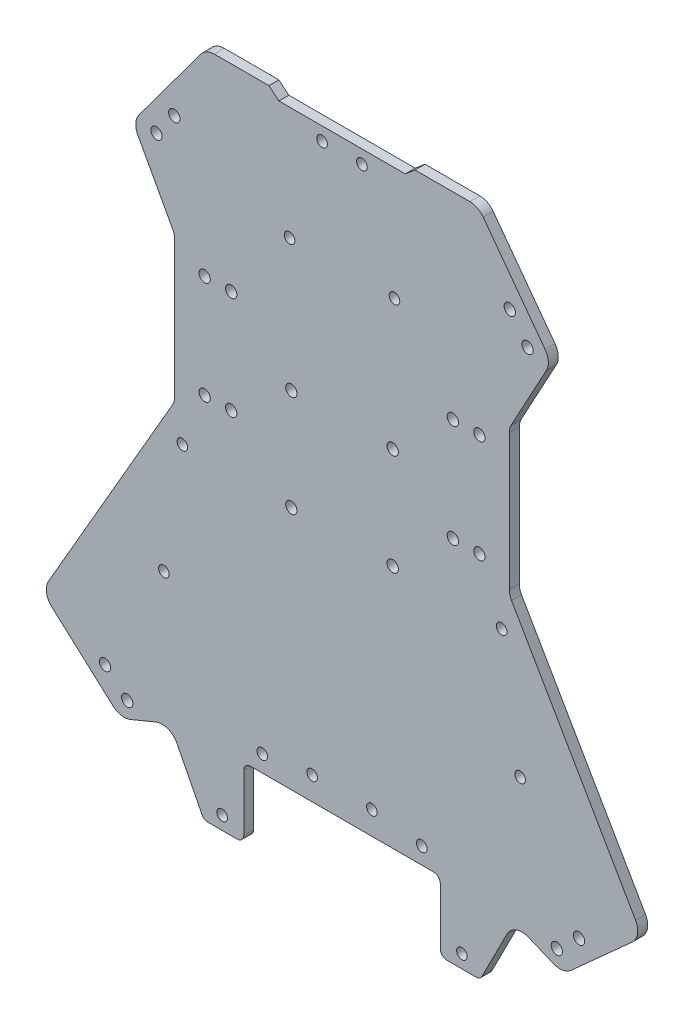
from build123d import *

# Parameters (mm, degrees)
BOSS_EXTRUDE1_DEPTH  = 3
SKETCH1_3_R          = 1.6
CUT_EXTRUDE1_DEPTH   = 219.249429386
MNTPATT_LNDGEAR_D    = 3.4
MNTPATT_REARARM_D    = 3.4
MNTPATT_FOREARM_D    = 3.4
FILLET1_R            = 5
FILLET2_R            = 2
M3_CLEARANCE_HOLE4_D = 3.4


with BuildPart() as part:
    # Sketch1 → Boss-Extrude1 (new body)
    with BuildSketch(Plane.XY):
        Polygon((0, 0), (19, 0), (21.979383981, 2.5), (40.979383981, 2.5), (62.987827091, -27.242703843), (50.343119944, -50.531357328), (50.343119944, -94.031357328), (90.343119944, -163.313389631), (66.562485529, -184.725569035), (51.780413009, -178.602634117), (41.565626765, -198.650280911), (29.565626765, -198.650280911), (29.565626765, -177.650280911), (0, -177.650280911), align=None)
    boss_extrude1 = extrude(amount=BOSS_EXTRUDE1_DEPTH)

    # Sketch1<3> → Cut-Extrude1 (cut, through all)
    with BuildSketch(Plane.XY):
        with Locations((6, -4)):
            Circle(SKETCH1_3_R)
        with Locations((48.043119944, -104.047640471)):
            Circle(SKETCH1_3_R)
        with Locations((53.591147617, -139.888439508)):
            Circle(SKETCH1_3_R)
        with Locations((36.065626765, -194.650280911)):
            Circle(SKETCH1_3_R)
        with Locations((24, -172.650280911)):
            Circle(SKETCH1_3_R)
        with Locations((9, -170.650280911)):
            Circle(SKETCH1_3_R)
        with Locations((15.778522962, -34.052256336)):
            Circle(SKETCH1_3_R)
    cut_extrude1 = extrude(amount=CUT_EXTRUDE1_DEPTH, mode=Mode.SUBTRACT)

    # MntPatt-Lndgear (through all)
    with Locations(Plane.XY.offset(3)):
        with Locations((33.343119944, -56.83261542), (41.343119944, -56.83261542), (33.343119944, -87.83261542), (41.343119944, -87.83261542)):
            mntpatt_lndgear = Hole(MNTPATT_LNDGEAR_D / 2)

    # MntPatt-RearArm (through all)
    with Locations(Plane.XY.offset(3)):
        with Locations((55.826108536, -26.810648111), (50.472703455, -19.575936365)):
            mntpatt_reararm = Hole(MNTPATT_REARARM_D / 2)

    # MntPatt_ForeArm (through all)
    with Locations(Plane.XY.offset(3)):
        with Locations((71.326111319, -173.035401095), (64.63780789, -179.057576552)):
            mntpatt_forearm = Hole(MNTPATT_FOREARM_D / 2)

    # Mirror2: Boss-Extrude1, Cut-Extrude1, MntPatt-Lndgear, MntPatt-RearArm, MntPatt_ForeArm across plane
    add(boss_extrude1.mirror(Plane(origin=(0, 0, 3), x_dir=(0, 0, 1), z_dir=(1, 0, 0))))
    add(cut_extrude1.mirror(Plane(origin=(0, 0, 3), x_dir=(0, 0, 1), z_dir=(1, 0, 0))), mode=Mode.SUBTRACT)
    add(mntpatt_lndgear.mirror(Plane(origin=(0, 0, 3), x_dir=(0, 0, 1), z_dir=(1, 0, 0))), mode=Mode.SUBTRACT)
    add(mntpatt_reararm.mirror(Plane(origin=(0, 0, 3), x_dir=(0, 0, 1), z_dir=(1, 0, 0))), mode=Mode.SUBTRACT)
    add(mntpatt_forearm.mirror(Plane(origin=(0, 0, 3), x_dir=(0, 0, 1), z_dir=(1, 0, 0))), mode=Mode.SUBTRACT)

    # Fillet1
    fillet1_edges = [part.edges().sort_by_distance(p)[0] for p in [
        (-40.979383981, 2.5, 1.5),
        (-62.987827091, -27.242703843, 1.5),
        (-50.343119944, -50.531357328, 1.5),
        (-50.343119944, -94.031357328, 1.5),
        (-90.343119944, -163.313389631, 1.5),
        (-66.562485529, -184.725569035, 1.5),
        (-51.780413009, -178.602634117, 1.5),
        (51.780413009, -178.602634117, 1.5),
        (66.562485529, -184.725569035, 1.5),
        (90.343119944, -163.313389631, 1.5),
        (50.343119944, -94.031357328, 1.5),
        (50.343119944, -50.531357328, 1.5),
        (62.987827091, -27.242703843, 1.5),
        (40.979383981, 2.5, 1.5),
    ]]
    fillet(fillet1_edges, radius=FILLET1_R)

    # Fillet2
    fillet2_edges = [part.edges().sort_by_distance(p)[0] for p in [
        (-41.565626765, -198.650280911, 1.5),
        (-29.565626765, -198.650280911, 1.5),
        (-29.565626765, -177.650280911, 1.5),
        (29.565626765, -177.650280911, 1.5),
        (29.565626765, -198.650280911, 1.5),
        (41.565626765, -198.650280911, 1.5),
    ]]
    fillet(fillet2_edges, radius=FILLET2_R)

    # M3 Clearance Hole4 (through all)
    with Locations(Plane.XY.offset(3)):
        with Locations((-15.25, -73.575140456), (15.25, -73.575140456), (15.25, -104.075140456), (-15.25, -104.075140456)):
            Hole(M3_CLEARANCE_HOLE4_D / 2)


solid = part.part
